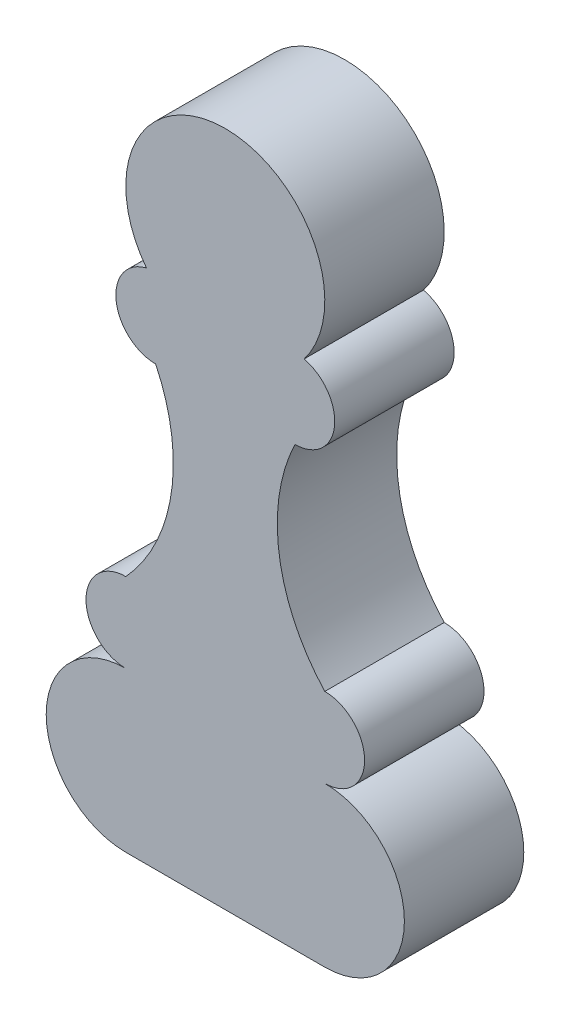
from build123d import *

# Parameters (mm, degrees)
BOSS_EXTRUDE3_DEPTH = 30


with BuildPart() as part:
    # Sketch1 → Boss-Extrude3 (new body)
    with BuildSketch(Plane.XY):
        with BuildLine():
            ThreePointArc((19.796695306, -15.267313286), (0, 25), (-19.796695306, -15.267313286))
            ThreePointArc((-19.796695306, -15.267313286), (-27.432946872, -26.156099663), (-17.5, -35))
            ThreePointArc((-17.5, -35), (-13.564166187, -61.152875072), (-25, -85))
            ThreePointArc((-25, -85), (-35, -95), (-25, -105))
            ThreePointArc((-25, -105), (-45, -125), (-25, -145))
            Line((-25, -145), (25, -145))
            ThreePointArc((25, -145), (45, -125), (25, -105))
            ThreePointArc((25, -105), (35, -95), (25, -85))
            ThreePointArc((25, -85), (13.564166187, -61.152875072), (17.5, -35))
            ThreePointArc((17.5, -35), (27.432946872, -26.156099663), (19.796695306, -15.267313286))
        make_face()
    extrude(amount=BOSS_EXTRUDE3_DEPTH)


solid = part.part
